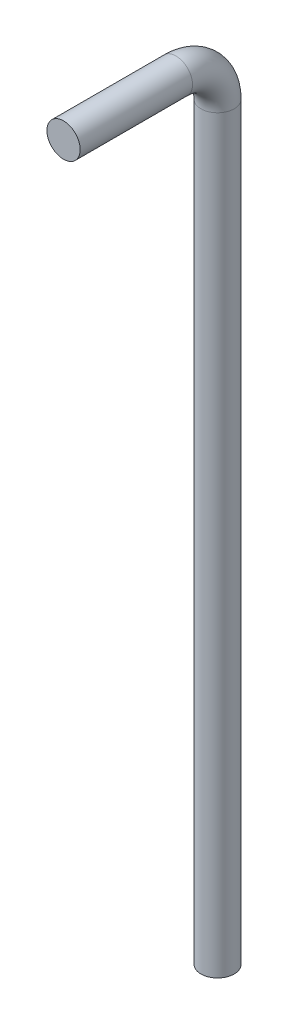
from build123d import *

# Parameters (mm, degrees)
SKETCH1_R = 5.08


with BuildPart() as part:
    # Sweep1: sweep along a path in Sketch2
    with BuildLine(Plane(origin=(0, 0, 0), x_dir=(0, 0, -1), z_dir=(1, 0, 0))) as sweep1_path:
        Line((0, 0), (0, 228.6))
        ThreePointArc((0, 228.6), (-3.719743879, 237.580256121), (-12.7, 241.3))
        Line((-12.7, 241.3), (-46.99, 241.3))
    # Sketch1 → Sweep1 (sweep)
    with BuildSketch(Plane(origin=(0, 0, 0), x_dir=(1, 0, 0), z_dir=(0, 1, 0))):
        Circle(SKETCH1_R)
    sweep(path=sweep1_path.line)


solid = part.part
